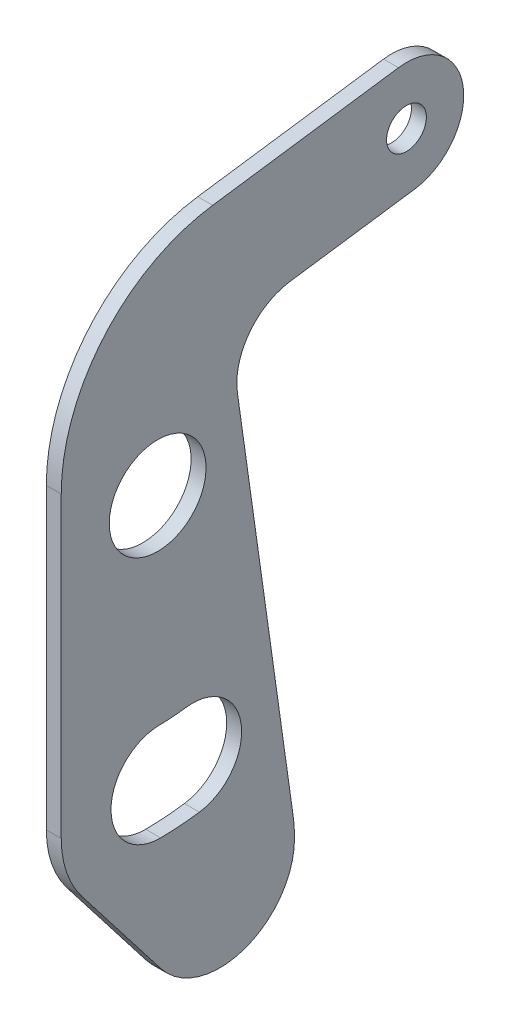
from build123d import *

# Parameters (mm, degrees)
SKETCH1_R           = 4.9403
SKETCH1_R_2         = 2.032
BOSS_EXTRUDE1_DEPTH = 1.524
FILLET1_R           = 6.35


with BuildPart() as part:
    # Sketch1 → Boss-Extrude1 (new body)
    with BuildSketch(Plane(origin=(0, 0, 0), x_dir=(0, 0, -1), z_dir=(1, 0, 0))):
        with BuildLine():
            Line((13.8142694, -35.103404086), (7.254069056, 11.286906181))
            Line((7.254069056, 11.286906181), (26.217997141, 13.968655167))
            ThreePointArc((26.217997141, 13.968655167), (31.18444852, 20.571100828), (24.582002859, 25.537552207))
            Line((24.582002859, 25.537552207), (5.618074774, 22.85580322))
            ThreePointArc((5.618074774, 22.85580322), (-5.437755223, 16.843791056), (-9.842503175, 5.055073455))
            Line((-9.842503175, 5.055073455), (-9.842503175, -25.39873))
            ThreePointArc((-9.842503175, -25.39873), (-9.299571879, -28.665017997), (-7.729169391, -31.580021889))
            Line((-7.729169391, -31.580021889), (0.324968894, -41.98197763))
            ThreePointArc((0.324968894, -41.98197763), (8.815123016, -44.527092206), (13.97, -37.316851675))
            ThreePointArc((13.97, -37.316851675), (13.931019289, -36.207392094), (13.8142694, -35.103404086))
        make_face()
        with Locations(Location((0, 0, 0), (0, 0, 180))):
            Circle(SKETCH1_R, mode=Mode.SUBTRACT)
        with Locations(Location((25.4, 19.753103687, 0), (0, 0, 180))):
            Circle(SKETCH1_R_2, mode=Mode.SUBTRACT)
        with BuildLine():
            ThreePointArc((0.304161198, -30.414979175), (2.286404707, -30.330443877), (4.258919897, -30.116856967))
            ThreePointArc((4.258919897, -30.116856967), (8.523590103, -24.447365584), (2.85409872, -20.182695379))
            ThreePointArc((2.85409872, -20.182695379), (1.532225284, -20.325829821), (0.203832452, -20.382480825))
            ThreePointArc((0.203832452, -20.382480825), (-4.76225235, -25.448894373), (0.304161198, -30.414979175))
        make_face(mode=Mode.SUBTRACT)
    extrude(amount=BOSS_EXTRUDE1_DEPTH)

    # Fillet1
    fillet1_edges = [part.edges().sort_by_distance(p)[0] for p in [
        (0.762, 11.286906181, -7.254069056),
    ]]
    fillet(fillet1_edges, radius=FILLET1_R)


solid = part.part
